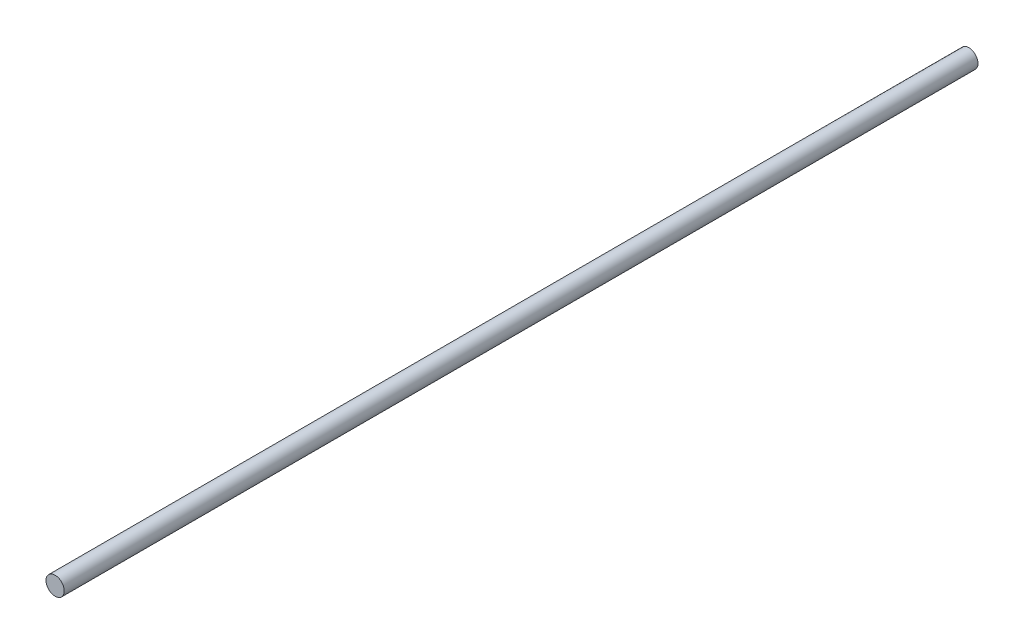
from build123d import *

# Parameters (mm, degrees)
ESQUISSE1_R        = 2.5
BOSS_EXTRU_1_DEPTH = 250


with BuildPart() as part:
    # Esquisse1 → Boss.-Extru.1 (new body)
    with BuildSketch(Plane.XY):
        Circle(ESQUISSE1_R)
    extrude(amount=BOSS_EXTRU_1_DEPTH)


solid = part.part
